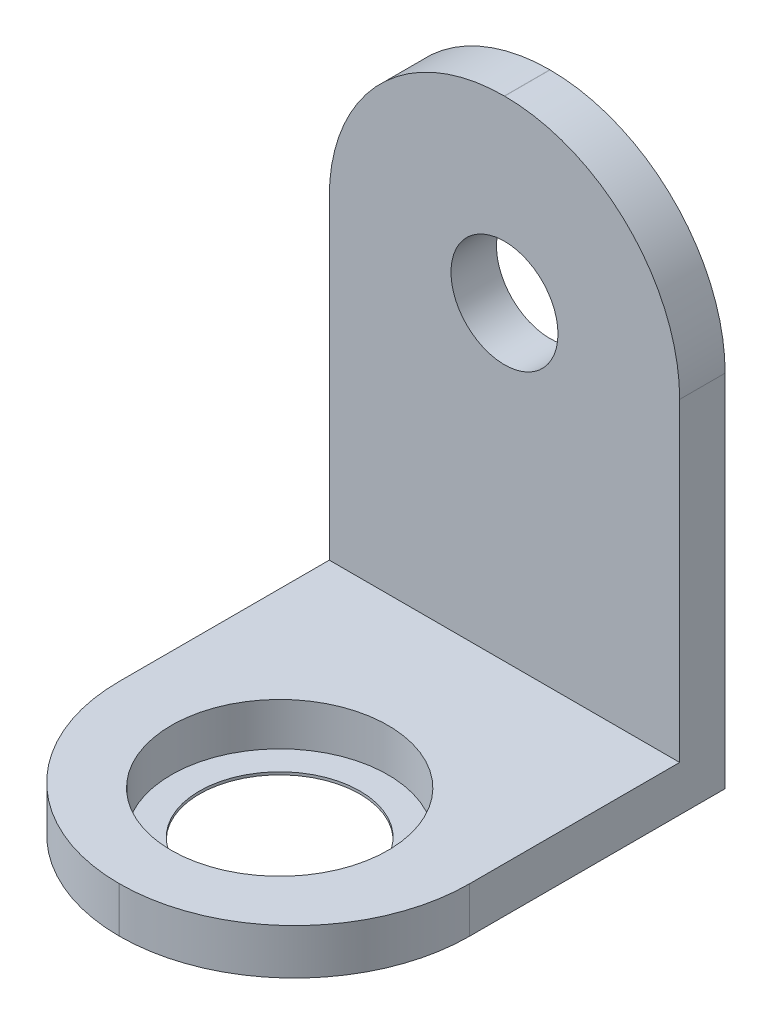
from build123d import *

# Parameters (mm, degrees)
SKETCH2_R           = 2.5
BOSS_EXTRUDE1_DEPTH = 1.7
SKETCH3_W           = 13.1
SKETCH3_H           = 1.7
BOSS_EXTRUDE2_DEPTH = 18.3
SKETCH4_R           = 2
CUT_EXTRUDE1_DEPTH  = 18.3
FILLET1_R           = 6.545
SKETCH5_R           = 4.05
CUT_EXTRUDE2_DEPTH  = 1.6
SKETCH7_R           = 2.5
SKETCH7_R_2         = 1.5
BOSS_EXTRUDE4_DEPTH = 0.1
SKETCH9_R           = 3
SKETCH9_R_2         = 1.5
CUT_EXTRUDE3_DEPTH  = 2


with BuildPart() as part:
    # Sketch2 → Boss-Extrude1 (new body)
    with BuildSketch(Plane(origin=(0, 0, 0), x_dir=(1, 0, 0), z_dir=(0, 1, 0))):
        with BuildLine():
            Line((-6.446031746, 10), (6.653968254, 10))
            Line((6.653968254, 10), (6.653968254, 0.445))
            ThreePointArc((6.653968254, 0.445), (4.736982137, -4.183013883), (0.108968254, -6.1))
            Line((0.108968254, -6.1), (0.098968254, -6.1))
            ThreePointArc((0.098968254, -6.1), (-4.529045629, -4.183013883), (-6.446031746, 0.445))
            Line((-6.446031746, 0.445), (-6.446031746, 10))
        make_face()
        with Locations(Location((0, 0, 0), (0, 0, 270))):
            Circle(SKETCH2_R, mode=Mode.SUBTRACT)
    extrude(amount=BOSS_EXTRUDE1_DEPTH)

    # Sketch3 → Boss-Extrude2 (add)
    with BuildSketch(Plane(origin=(0, 1.7, 0), x_dir=(1, 0, 0), z_dir=(0, 1, 0))):
        with Locations((0.103968254, 9.15)):
            Rectangle(SKETCH3_W, SKETCH3_H)
    extrude(amount=BOSS_EXTRUDE2_DEPTH)

    # Sketch4 → Cut-Extrude1 (cut)
    with BuildSketch(Plane.XY.offset(-8.3)):
        with Locations((0.103968254, 13.3)):
            Circle(SKETCH4_R)
    extrude(amount=-CUT_EXTRUDE1_DEPTH, mode=Mode.SUBTRACT)

    # Fillet1
    fillet1_edges = [part.edges().sort_by_distance(p)[0] for p in [
        (-6.446031746, 20, -9.15),
        (6.653968254, 20, -9.15),
    ]]
    fillet(fillet1_edges, radius=FILLET1_R)

    # Sketch5 → Cut-Extrude2 (cut)
    with BuildSketch(Plane(origin=(0, 1.7, 0), x_dir=(1, 0, 0), z_dir=(0, 1, 0))):
        with Locations(Location((0, 0, 0), (0, 0, 270))):
            Circle(SKETCH5_R)
    extrude(amount=-CUT_EXTRUDE2_DEPTH, mode=Mode.SUBTRACT)

    # Sketch7 → Boss-Extrude4 (add)
    with BuildSketch(Plane.XZ):
        Circle(SKETCH7_R)
        with Locations(Location((0, 0, 0), (0, 0, 270))):
            Circle(SKETCH7_R_2, mode=Mode.SUBTRACT)
    extrude(amount=-BOSS_EXTRUDE4_DEPTH)

    # Sketch9 → Cut-Extrude3 (cut)
    with BuildSketch(Plane.XZ):
        with Locations(Location((0, 0, 0), (0, 0, 270))):
            Circle(SKETCH9_R)
        Circle(SKETCH9_R_2, mode=Mode.SUBTRACT)
    extrude(amount=-CUT_EXTRUDE3_DEPTH, mode=Mode.SUBTRACT)


solid = part.part
